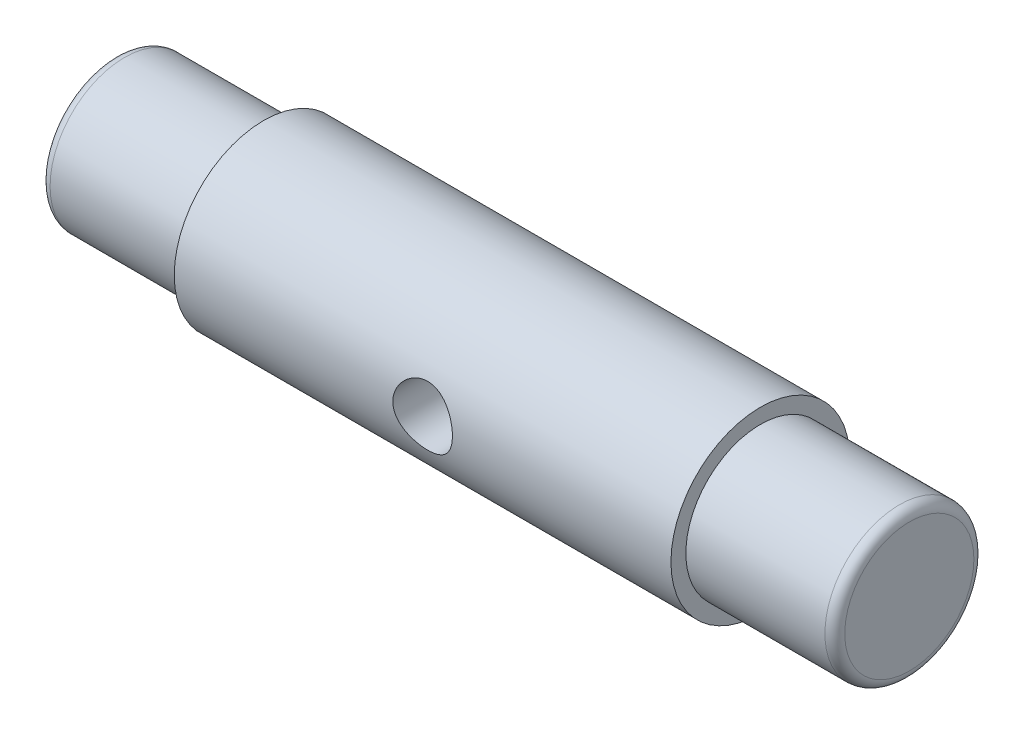
from build123d import *

# Parameters (mm, degrees)
BOSS_EXTRUDE2_DEPTH      = 25
BOSS_EXTRUDE2_DEPTH_BACK = 25
SKETCH1_R                = 9
SKETCH2_R                = 7.5
BOSS_EXTRUDE3_DEPTH      = 15
FILLET2_R                = 1
CUT_EXTRUDE1_DEPTH       = 42.976183724
CUT_EXTRUDE1_DEPTH_BACK  = 42.976183724
SKETCH3_R                = 3


with BuildPart() as part:
    # Sketch1 → Boss-Extrude2 (new, two sides: drawn at the far end of the back side and taken through both)
    with BuildSketch(Plane(origin=(0, 0, 0), x_dir=(0, 0, -1), z_dir=(1, 0, 0)).offset(-BOSS_EXTRUDE2_DEPTH_BACK)):
        Circle(SKETCH1_R)
    extrude(amount=BOSS_EXTRUDE2_DEPTH + BOSS_EXTRUDE2_DEPTH_BACK)

    # Sketch2 → Boss-Extrude3 (add)
    with BuildSketch(Plane(origin=(25, 0, 0), x_dir=(0, 0, -1), z_dir=(1, 0, 0))):
        Circle(SKETCH2_R)
    boss_extrude3 = extrude(amount=BOSS_EXTRUDE3_DEPTH)

    # Mirror1: Boss-Extrude3 across plane
    add(boss_extrude3.mirror(Plane(origin=(0, 0, 0), x_dir=(0, 0, 1), z_dir=(1, 0, 0))))

    # Fillet2
    fillet2_edges = [part.edges().sort_by_distance(p)[0] for p in [
        (40, 0, 7.5),
        (-40, 0, 7.5),
    ]]
    fillet(fillet2_edges, radius=FILLET2_R)

    # Sketch3 → Cut-Extrude1 (cut, two sides: drawn at the far end of the back side and taken through both)
    with BuildSketch(Plane.XY.offset(-CUT_EXTRUDE1_DEPTH_BACK)):
        Circle(SKETCH3_R)
    extrude(amount=CUT_EXTRUDE1_DEPTH + CUT_EXTRUDE1_DEPTH_BACK, mode=Mode.SUBTRACT)


solid = part.part
